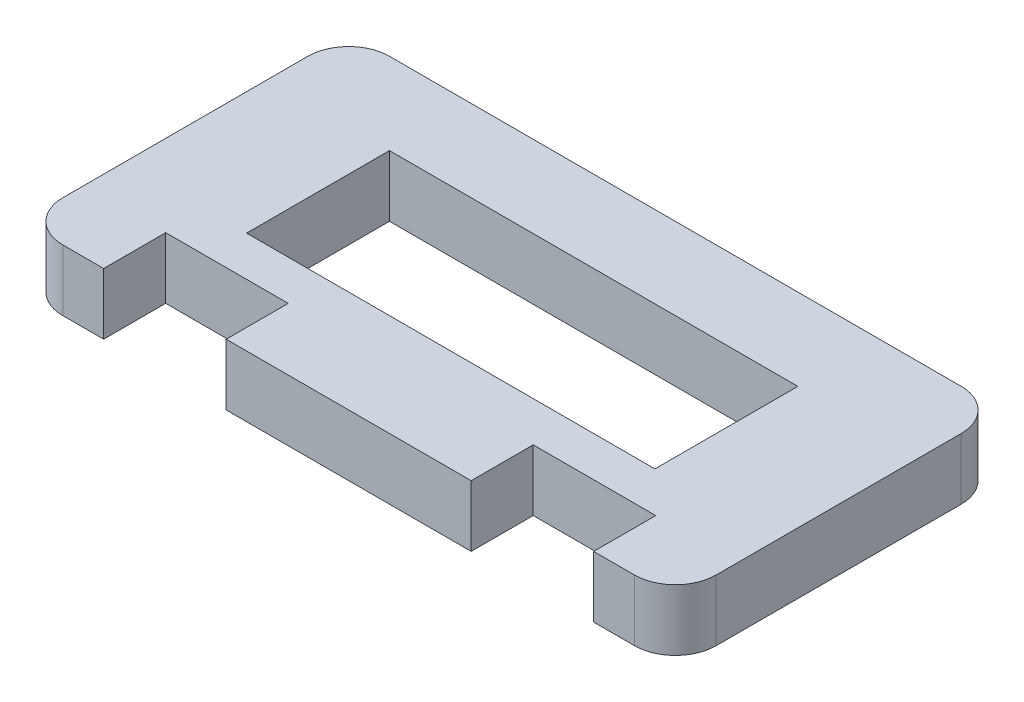
from build123d import *

# Parameters (mm, degrees)
SKETCH1_W           = 50
SKETCH1_H           = 17.5
BOSS_EXTRUDE1_DEPTH = 7.5


with BuildPart() as part:
    # Sketch1 → Boss-Extrude1 (new body)
    with BuildSketch(Plane(origin=(0, 0, 0), x_dir=(1, 0, 0), z_dir=(0, 1, 0))):
        with BuildLine():
            Line((15, -20), (15, -12.4))
            Line((15, -12.4), (30, -12.4))
            Line((30, -12.4), (30, -20))
            Line((30, -20), (35, -20))
            ThreePointArc((35, -20), (38.535533906, -18.535533906), (40, -15))
            Line((40, -15), (40, 15))
            ThreePointArc((40, 15), (38.535533906, 18.535533906), (35, 20))
            Line((35, 20), (-35, 20))
            ThreePointArc((-35, 20), (-38.535533906, 18.535533906), (-40, 15))
            Line((-40, 15), (-40, -15))
            ThreePointArc((-40, -15), (-38.535533906, -18.535533906), (-35, -20))
            Line((-35, -20), (-30, -20))
            Line((-30, -20), (-30, -12.4))
            Line((-30, -12.4), (-15, -12.4))
            Line((-15, -12.4), (-15, -20))
            Line((-15, -20), (15, -20))
        make_face()
        with Locations((0, 1.25)):
            Rectangle(SKETCH1_W, SKETCH1_H, mode=Mode.SUBTRACT)
    extrude(amount=BOSS_EXTRUDE1_DEPTH)


solid = part.part
